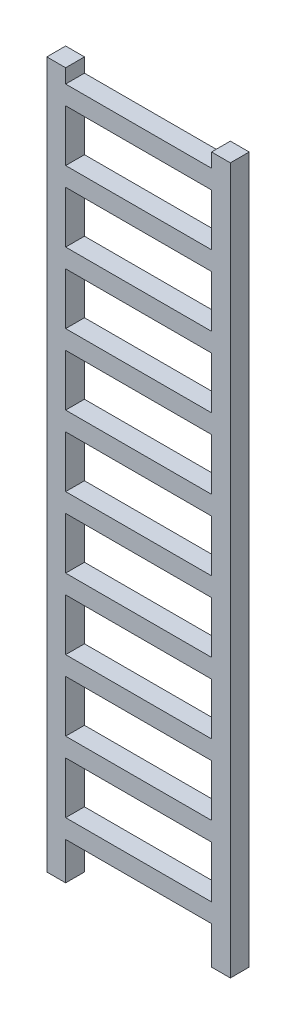
from build123d import *

# Parameters (mm, degrees)
SKETCH_1_W       = 80
SKETCH_1_H       = 3000
EXTRUDE_1_DEPTH  = 80
SKETCH_2_W       = 80
SKETCH_2_H       = 3000
EXTRUDE_2_DEPTH  = 80
SKETCH_3_W       = 720
SKETCH_3_H       = 80
EXTRUDE_3_DEPTH  = 80
SKETCH_4_W       = 720
SKETCH_4_H       = 80
EXTRUDE_4_DEPTH  = 80
SKETCH_5_W       = 720
SKETCH_5_H       = 80
EXTRUDE_5_DEPTH  = 80
SKETCH_6_W       = 720
SKETCH_6_H       = 80
EXTRUDE_6_DEPTH  = 80
SKETCH_7_W       = 720
SKETCH_7_H       = 80
EXTRUDE_7_DEPTH  = 80
SKETCH_8_W       = 720
SKETCH_8_H       = 80
EXTRUDE_8_DEPTH  = 80
SKETCH_9_W       = 720
SKETCH_9_H       = 80
EXTRUDE_9_DEPTH  = 80
SKETCH_10_W      = 720
SKETCH_10_H      = 80
EXTRUDE_10_DEPTH = 80
SKETCH_11_W      = 720
SKETCH_11_H      = 80
EXTRUDE_11_DEPTH = 80
SKETCH_12_W      = 720
SKETCH_12_H      = 80
EXTRUDE_12_DEPTH = 80


with BuildPart() as part:
    # 草图1 → 凸台-拉伸1 (new body)
    with BuildSketch(Plane.XY):
        with Locations((-350, 0)):
            Rectangle(SKETCH_1_W, SKETCH_1_H)
    extrude(amount=EXTRUDE_1_DEPTH)



with BuildPart() as body_2:
    # 草图2 → 凸台-拉伸2 (new body)
    with BuildSketch(Plane.XY):
        with Locations((350, 0)):
            Rectangle(SKETCH_2_W, SKETCH_2_H)
    extrude(amount=EXTRUDE_2_DEPTH)


with BuildPart() as part_1:
    add(part.part)

    add(body_2.part)  # 凸台-拉伸3 merges body 2
    # 草图3 → 凸台-拉伸3 (add)
    with BuildSketch(Plane.XY):
        with Locations((0, 1400)):
            Rectangle(SKETCH_3_W, SKETCH_3_H)
    extrude(amount=EXTRUDE_3_DEPTH)

    # 草图4 → 凸台-拉伸4 (add)
    with BuildSketch(Plane.XY):
        with Locations((0, 1100)):
            Rectangle(SKETCH_4_W, SKETCH_4_H)
    extrude(amount=EXTRUDE_4_DEPTH)

    # 草图5 → 凸台-拉伸5 (add)
    with BuildSketch(Plane.XY):
        with Locations((0, 800)):
            Rectangle(SKETCH_5_W, SKETCH_5_H)
    extrude(amount=EXTRUDE_5_DEPTH)

    # 草图6 → 凸台-拉伸6 (add)
    with BuildSketch(Plane.XY):
        with Locations((0, 500)):
            Rectangle(SKETCH_6_W, SKETCH_6_H)
    extrude(amount=EXTRUDE_6_DEPTH)

    # 草图7 → 凸台-拉伸7 (add)
    with BuildSketch(Plane.XY):
        with Locations((0, 200)):
            Rectangle(SKETCH_7_W, SKETCH_7_H)
    extrude(amount=EXTRUDE_7_DEPTH)

    # 草图8 → 凸台-拉伸8 (add)
    with BuildSketch(Plane.XY):
        with Locations((0, -100)):
            Rectangle(SKETCH_8_W, SKETCH_8_H)
    extrude(amount=EXTRUDE_8_DEPTH)

    # 草图9 → 凸台-拉伸9 (add)
    with BuildSketch(Plane.XY):
        with Locations((0, -400)):
            Rectangle(SKETCH_9_W, SKETCH_9_H)
    extrude(amount=EXTRUDE_9_DEPTH)

    # 草图10 → 凸台-拉伸10 (add)
    with BuildSketch(Plane.XY):
        with Locations((0, -700)):
            Rectangle(SKETCH_10_W, SKETCH_10_H)
    extrude(amount=EXTRUDE_10_DEPTH)

    # 草图11 → 凸台-拉伸11 (add)
    with BuildSketch(Plane.XY):
        with Locations((0, -1000)):
            Rectangle(SKETCH_11_W, SKETCH_11_H)
    extrude(amount=EXTRUDE_11_DEPTH)

    # 草图12 → 凸台-拉伸12 (add)
    with BuildSketch(Plane.XY):
        with Locations((0, -1300)):
            Rectangle(SKETCH_12_W, SKETCH_12_H)
    extrude(amount=EXTRUDE_12_DEPTH)


solid = part_1.part
